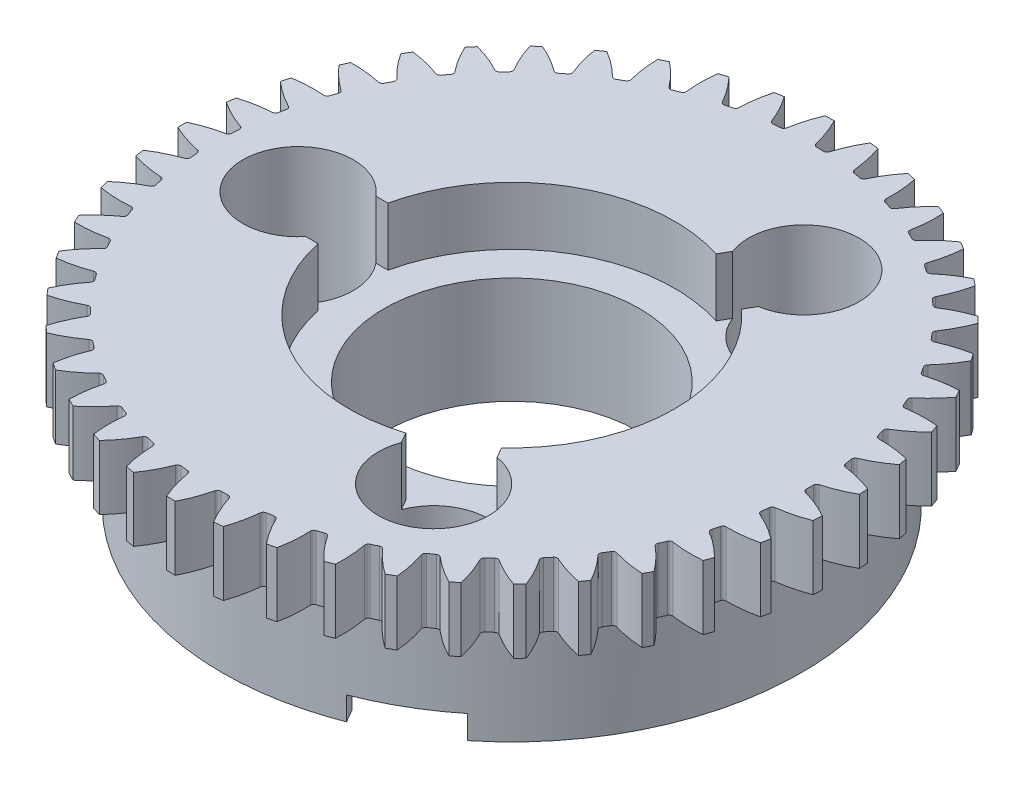
from build123d import *
from build123d.topology import SkipClean

# Parameters (mm, degrees)
SKETCH2_R           = 26.56
SKETCH2_R_2         = 4.926
SKETCH2_R_3         = 11.375
BOSS_EXTRUDE2_DEPTH = 5.72
BOSS_EXTRUDE3_START = 8.98
SKETCH4_R           = 25.815
SKETCH4_R_2         = 4.926
SKETCH4_R_3         = 11.375
BOSS_EXTRUDE3_DEPTH = 8.98
CUT_EXTRUDE7_START  = -5.178
CUT_EXTRUDE7_DEPTH  = 5.178
BOSS_EXTRUDE4_START = -5.72
BOSS_EXTRUDE4_DEPTH = 5.72
CIRPATTERN2_COUNT   = 45
CUT_EXTRUDE8_DEPTH  = 2.0875


with BuildPart() as part:
    # Sketch2 → Boss-Extrude2 (new body)
    with BuildSketch(Plane(origin=(0, 0, 0), x_dir=(1, 0, 0), z_dir=(0, 1, 0))):
        with Locations(Location((0, 0, 0), (0, 0, 270))):
            Circle(SKETCH2_R)
        with Locations(Location((-19.0525, 0, 0), (0, 0, 270))):
            Circle(SKETCH2_R_2, mode=Mode.SUBTRACT)
        with Locations(Location((9.52625, 16.499949006, 0), (0, 0, 270))):
            Circle(SKETCH2_R_2, mode=Mode.SUBTRACT)
        with Locations(Location((9.52625, -16.499949006, 0), (0, 0, 270))):
            Circle(SKETCH2_R_2, mode=Mode.SUBTRACT)
        with Locations(Location((0, 0, 0), (0, 0, 270))):
            Circle(SKETCH2_R_3, mode=Mode.SUBTRACT)
    extrude(amount=BOSS_EXTRUDE2_DEPTH)

    # Sketch4 → Boss-Extrude3 (add)
    with SkipClean():  # the faces are left unmerged after this step: merging them gives an invalid solid
        with BuildSketch(Plane.XZ.offset(BOSS_EXTRUDE3_START)):
            with Locations(Location((0, 0, 0), (0, 0, 90))):
                Circle(SKETCH4_R)
            with Locations(Location((9.52625, -16.499949006, 0), (0, 0, 270))):
                Circle(SKETCH4_R_2, mode=Mode.SUBTRACT)
            with Locations(Location((9.52625, 16.499949006, 0), (0, 0, 270))):
                Circle(SKETCH4_R_2, mode=Mode.SUBTRACT)
            with Locations(Location((0, 0, 0), (0, 0, 270))):
                Circle(SKETCH4_R_3, mode=Mode.SUBTRACT)
            with Locations(Location((-19.0525, 0, 0), (0, 0, 270))):
                Circle(SKETCH4_R_2, mode=Mode.SUBTRACT)
        extrude(amount=-BOSS_EXTRUDE3_DEPTH)

    # Sketch7 → Cut-Extrude7 (cut)
    with SkipClean():  # the faces are left unmerged after this step: merging them gives an invalid solid
        with BuildSketch(Plane(origin=(0, 5.72, 0), x_dir=(1, 0, 0), z_dir=(0, 1, 0)).offset(CUT_EXTRUDE7_START)):
            with BuildLine():
                Line((9.784257247, -10.701322821), (10.325779643, -11.639267124))
                ThreePointArc((10.325779643, -11.639267124), (7.06325, -12.233907867), (4.91701119, -14.762021047))
                Line((4.91701119, -14.762021047), (4.375488794, -13.824076744))
                ThreePointArc((4.375488794, -13.824076744), (-7.25, -12.557368355), (-14.159746041, -3.122753923))
                Line((-14.159746041, -3.122753923), (-15.242790833, -3.122753923))
                ThreePointArc((-15.242790833, -3.122753923), (-14.1265, 0), (-15.242790833, 3.122753923))
                Line((-15.242790833, 3.122753923), (-14.159746041, 3.122753923))
                ThreePointArc((-14.159746041, 3.122753923), (-7.25, 12.557368355), (4.375488794, 13.824076744))
                Line((4.375488794, 13.824076744), (4.91701119, 14.762021047))
                ThreePointArc((4.91701119, 14.762021047), (7.06325, 12.233907867), (10.325779643, 11.639267124))
                Line((10.325779643, 11.639267124), (9.784257247, 10.701322821))
                ThreePointArc((9.784257247, 10.701322821), (14.5, 0), (9.784257247, -10.701322821))
            make_face()
        extrude(amount=CUT_EXTRUDE7_DEPTH, mode=Mode.SUBTRACT)

    # Sketch12 → Boss-Extrude4 (add)
    with SkipClean():  # the faces are left unmerged after this step: merging them gives an invalid solid
        with BuildSketch(Plane(origin=(0, 5.72, 0), x_dir=(1, 0, 0), z_dir=(0, 1, 0)).offset(BOSS_EXTRUDE4_START)):
            with BuildLine():
                ThreePointArc((14.590844282, -22.193261661), (13.28, -23.001634725), (11.92450625, -23.732672641))
                ThreePointArc((11.92450625, -23.732672641), (12.116486936, -23.706258751), (12.284561723, -23.80272192))
                ThreePointArc((12.284561723, -23.80272192), (13.259948402, -24.783941499), (14.34840202, -25.638013953))
                ThreePointArc((14.34840202, -25.638013953), (14.69, -25.443826363), (15.028970376, -25.24508763))
                ThreePointArc((15.028970376, -25.24508763), (14.833548744, -23.875422918), (14.471481, -22.540103486))
                ThreePointArc((14.471481, -22.540103486), (14.471978839, -22.346314866), (14.590844282, -22.193261661))
            make_face()
        boss_extrude4 = extrude(amount=BOSS_EXTRUDE4_DEPTH)

    # CirPattern2: Boss-Extrude4 ×45 about axis
    with SkipClean():  # the faces are left unmerged after this step: merging them gives an invalid solid
        cirpattern2_axis = Axis((0, 0, 0), (0, 1, 0))
        for i in range(1, CIRPATTERN2_COUNT):
            add(boss_extrude4.rotate(cirpattern2_axis, i * 360 / CIRPATTERN2_COUNT))

    # Sketch9 → Cut-Extrude8 (cut)
    with SkipClean():  # the faces are left unmerged after this step: merging them gives an invalid solid
        with BuildSketch(Plane.XZ.offset(8.98)):
            with BuildLine():
                Line((8.652884696, -22.890546243), (9.333143999, -24.068789918))
                ThreePointArc((9.333143999, -24.068789918), (12.9075, -22.356445799), (16.177611507, -20.117134759))
                Line((16.177611507, -20.117134759), (15.497352205, -18.938891084))
                ThreePointArc((15.497352205, -18.938891084), (6.30125, -10.914085151), (8.652884696, -22.890546243))
            make_face()
            with BuildLine():
                Line((-24.150236901, 3.951655158), (-25.510755506, 3.951655158))
                ThreePointArc((-25.510755506, 3.951655158), (-25.815, 0), (-25.510755506, -3.951655158))
                Line((-25.510755506, -3.951655158), (-24.150236901, -3.951655158))
                ThreePointArc((-24.150236901, -3.951655158), (-12.6025, 0), (-24.150236901, 3.951655158))
            make_face()
            with BuildLine():
                Line((15.497352205, 18.938891084), (16.177611507, 20.117134759))
                ThreePointArc((16.177611507, 20.117134759), (12.9075, 22.356445799), (9.333143999, 24.068789918))
                Line((9.333143999, 24.068789918), (8.652884696, 22.890546243))
                ThreePointArc((8.652884696, 22.890546243), (6.30125, 10.914085151), (15.497352205, 18.938891084))
            make_face()
        extrude(amount=-CUT_EXTRUDE8_DEPTH, mode=Mode.SUBTRACT)


solid = part.part
